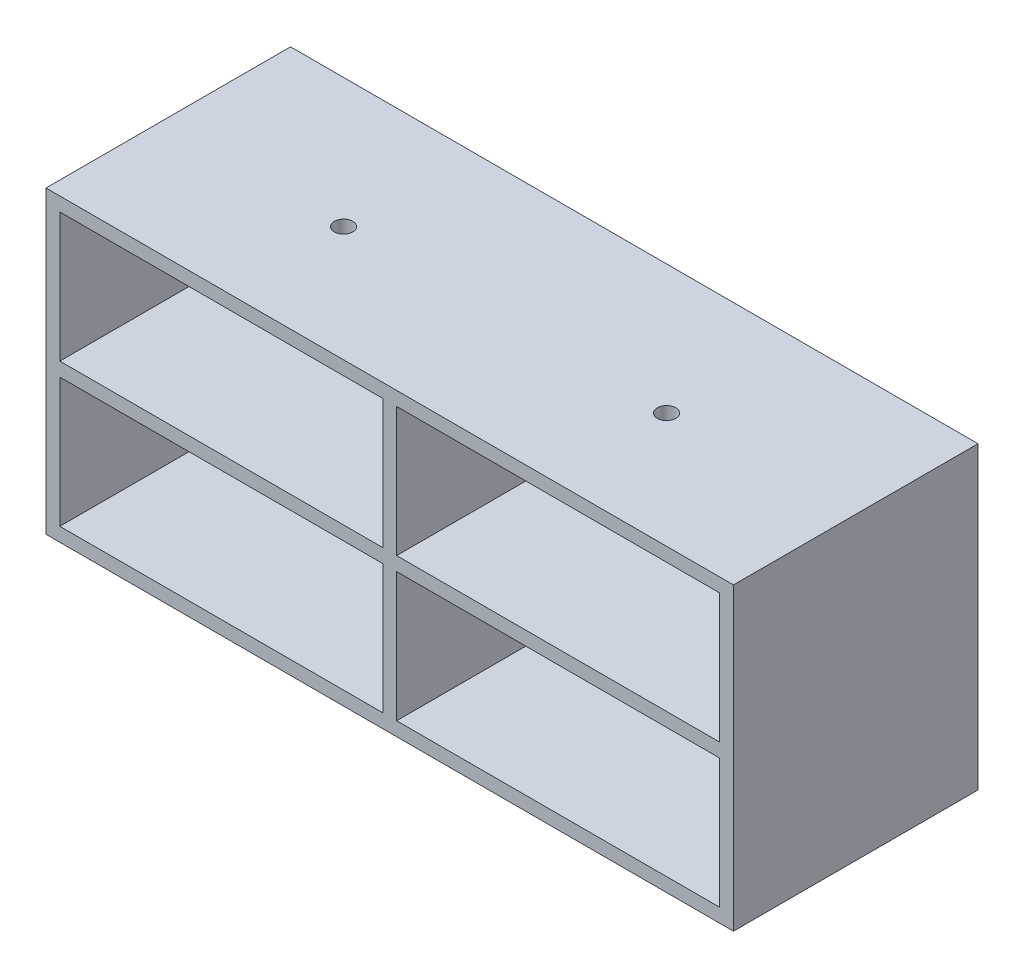
from build123d import *

# Parameters (mm, degrees)
SKETCH1_W           = 149
SKETCH1_H           = 65
BOSS_EXTRUDE1_DEPTH = 3
SKETCH2_W           = 149
SKETCH2_H           = 65
SKETCH2_W_2         = 143
SKETCH2_H_2         = 59
BOSS_EXTRUDE2_DEPTH = 50
BOSS_EXTRUDE3_DEPTH = 50
SKETCH5_R           = 2
CUT_EXTRUDE1_DEPTH  = 3


with BuildPart() as part:
    # Sketch1 → Boss-Extrude1 (new body)
    with BuildSketch(Plane.XY):
        with Locations((74.5, -32.5)):
            Rectangle(SKETCH1_W, SKETCH1_H)
    extrude(amount=BOSS_EXTRUDE1_DEPTH)

    # Sketch2 → Boss-Extrude2 (add)
    with BuildSketch(Plane.XY.offset(3)):
        with Locations((74.5, -32.5)):
            Rectangle(SKETCH2_W, SKETCH2_H)
        with Locations((74.5, -32.5)):
            Rectangle(SKETCH2_W_2, SKETCH2_H_2, mode=Mode.SUBTRACT)
    extrude(amount=BOSS_EXTRUDE2_DEPTH)

    # Sketch4 → Boss-Extrude3 (add)
    with BuildSketch(Plane.XY.offset(3)):
        Polygon((73, -3), (73, -31), (3, -31), (3, -34), (73, -34), (73, -62), (76, -62), (76, -34), (146, -34), (146, -31), (76, -31), (76, -3), align=None)
    extrude(amount=BOSS_EXTRUDE3_DEPTH)

    # Sketch5 → Cut-Extrude1 (cut)
    with BuildSketch(Plane(origin=(0, 0, 0), x_dir=(1, 0, 0), z_dir=(0, 1, 0))):
        with Locations(Location((39.5, -28, 0), (0, 0, 270))):
            Circle(SKETCH5_R)
        with Locations(Location((109.5, -28, 0), (0, 0, 270))):
            Circle(SKETCH5_R)
    extrude(amount=-CUT_EXTRUDE1_DEPTH, mode=Mode.SUBTRACT)


solid = part.part
